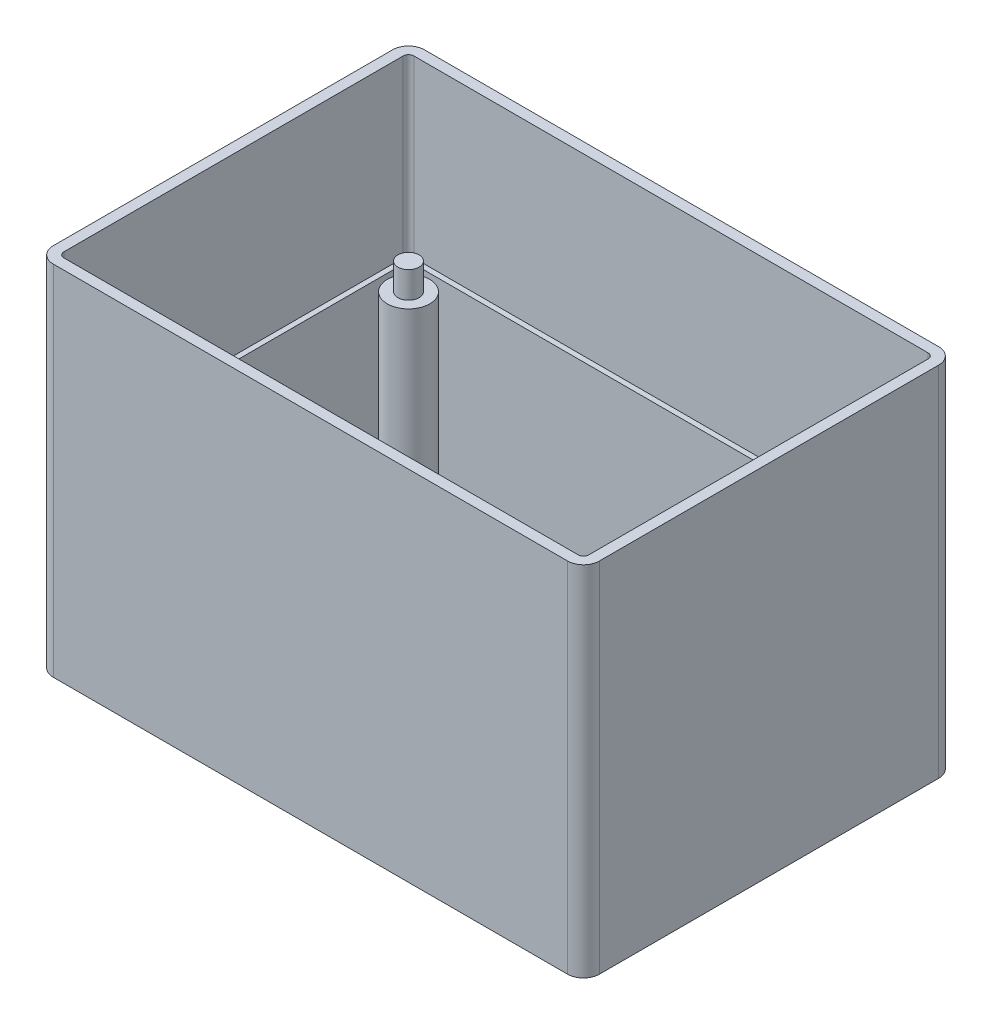
from build123d import *

# Parameters (mm, degrees)
BOSS_EXTRUDE4_DEPTH  = 2.5
BOSS_EXTRUDE5_START  = 65
BOSS_EXTRUDE5_DEPTH  = 65
BOSS_EXTRUDE6_START  = 32
SKETCH1_9_W          = 97
SKETCH1_9_H          = 64
SKETCH1_9_R          = 4
BOSS_EXTRUDE6_DEPTH  = 32
SKETCH3_R            = 2
BOSS_EXTRUDE7_DEPTH  = 5
SKETCH6_R            = 2
BOSS_EXTRUDE8_DEPTH  = 5
SKETCH5_R            = 2
BOSS_EXTRUDE9_DEPTH  = 5
SKETCH4_R            = 2
BOSS_EXTRUDE10_DEPTH = 5


with BuildPart() as part:
    # Sketch1 → Boss-Extrude4 (new body)
    with BuildSketch(Plane(origin=(0, 0, 0), x_dir=(1, 0, 0), z_dir=(0, 1, 0))):
        with BuildLine():
            ThreePointArc((0, 3), (0.878679656, 0.878679656), (3, 0))
            Line((3, 0), (100, 0))
            ThreePointArc((100, 0), (102.121320344, 0.878679656), (103, 3))
            Line((103, 3), (103, 67))
            ThreePointArc((103, 67), (102.121320344, 69.121320344), (100, 70))
            Line((100, 70), (3, 70))
            ThreePointArc((3, 70), (0.878679656, 69.121320344), (0, 67))
            Line((0, 67), (0, 3))
        make_face()
    extrude(amount=-BOSS_EXTRUDE4_DEPTH)

    # Sketch1<8> → Boss-Extrude5 (add)
    with BuildSketch(Plane(origin=(0, 0, 0), x_dir=(1, 0, 0), z_dir=(0, 1, 0)).offset(BOSS_EXTRUDE5_START)):
        with BuildLine():
            ThreePointArc((0, 3), (0.878679656, 0.878679656), (3, 0))
            Line((3, 0), (100, 0))
            ThreePointArc((100, 0), (102.121320344, 0.878679656), (103, 3))
            Line((103, 3), (103, 67))
            ThreePointArc((103, 67), (102.121320344, 69.121320344), (100, 70))
            Line((100, 70), (3, 70))
            ThreePointArc((3, 70), (0.878679656, 69.121320344), (0, 67))
            Line((0, 67), (0, 3))
        make_face()
        with BuildLine():
            Line((100, 2), (3, 2))
            ThreePointArc((3, 2), (2.292893219, 2.292893219), (2, 3))
            Line((2, 3), (2, 67))
            ThreePointArc((2, 67), (2.292893219, 67.707106781), (3, 68))
            Line((3, 68), (100, 68))
            ThreePointArc((100, 68), (100.707106781, 67.707106781), (101, 67))
            Line((101, 67), (101, 3))
            ThreePointArc((101, 3), (100.707106781, 2.292893219), (100, 2))
        make_face(mode=Mode.SUBTRACT)
    extrude(amount=-BOSS_EXTRUDE5_DEPTH)

    # Sketch1<9> → Boss-Extrude6 (add)
    # profile 1 of 5: a face of its own
    with BuildSketch(Plane(origin=(0, 0, 0), x_dir=(1, 0, 0), z_dir=(0, 1, 0)).offset(BOSS_EXTRUDE6_START)):
        with BuildLine():
            ThreePointArc((2, 3), (2.292893219, 2.292893219), (3, 2))
            Line((3, 2), (100, 2))
            ThreePointArc((100, 2), (100.707106781, 2.292893219), (101, 3))
            Line((101, 3), (101, 67))
            ThreePointArc((101, 67), (100.707106781, 67.707106781), (100, 68))
            Line((100, 68), (3, 68))
            ThreePointArc((3, 68), (2.292893219, 67.707106781), (2, 67))
            Line((2, 67), (2, 3))
        make_face()
        with Locations((51.5, 35)):
            Rectangle(SKETCH1_9_W, SKETCH1_9_H, mode=Mode.SUBTRACT)
    # profile 2 of 5: a face of its own
    with BuildSketch(Plane(origin=(0, 0, 0), x_dir=(1, 0, 0), z_dir=(0, 1, 0)).offset(BOSS_EXTRUDE6_START)):
        with Locations((95, 8)):
            Circle(SKETCH1_9_R)
    # profile 3 of 5: a face of its own
    with BuildSketch(Plane(origin=(0, 0, 0), x_dir=(1, 0, 0), z_dir=(0, 1, 0)).offset(BOSS_EXTRUDE6_START)):
        with Locations((95, 62)):
            Circle(SKETCH1_9_R)
    # profile 4 of 5: a face of its own
    with BuildSketch(Plane(origin=(0, 0, 0), x_dir=(1, 0, 0), z_dir=(0, 1, 0)).offset(BOSS_EXTRUDE6_START)):
        with Locations((8, 8)):
            Circle(SKETCH1_9_R)
    # profile 5 of 5: a face of its own
    with BuildSketch(Plane(origin=(0, 0, 0), x_dir=(1, 0, 0), z_dir=(0, 1, 0)).offset(BOSS_EXTRUDE6_START)):
        with Locations((8, 62)):
            Circle(SKETCH1_9_R)
    extrude(amount=-BOSS_EXTRUDE6_DEPTH)

    # Sketch3 → Boss-Extrude7 (add)
    with BuildSketch(Plane(origin=(0, 32, 0), x_dir=(1, 0, 0), z_dir=(0, 1, 0))):
        with Locations((8, 62)):
            Circle(SKETCH3_R)
    extrude(amount=BOSS_EXTRUDE7_DEPTH)

    # Sketch6 → Boss-Extrude8 (add)
    with BuildSketch(Plane(origin=(0, 32, 0), x_dir=(1, 0, 0), z_dir=(0, 1, 0))):
        with Locations((95, 62)):
            Circle(SKETCH6_R)
    extrude(amount=BOSS_EXTRUDE8_DEPTH)

    # Sketch5 → Boss-Extrude9 (add)
    with BuildSketch(Plane(origin=(0, 32, 0), x_dir=(1, 0, 0), z_dir=(0, 1, 0))):
        with Locations((95, 8)):
            Circle(SKETCH5_R)
    extrude(amount=BOSS_EXTRUDE9_DEPTH)

    # Sketch4 → Boss-Extrude10 (add)
    with BuildSketch(Plane(origin=(0, 32, 0), x_dir=(1, 0, 0), z_dir=(0, 1, 0))):
        with Locations((8, 8)):
            Circle(SKETCH4_R)
    extrude(amount=BOSS_EXTRUDE10_DEPTH)


solid = part.part
